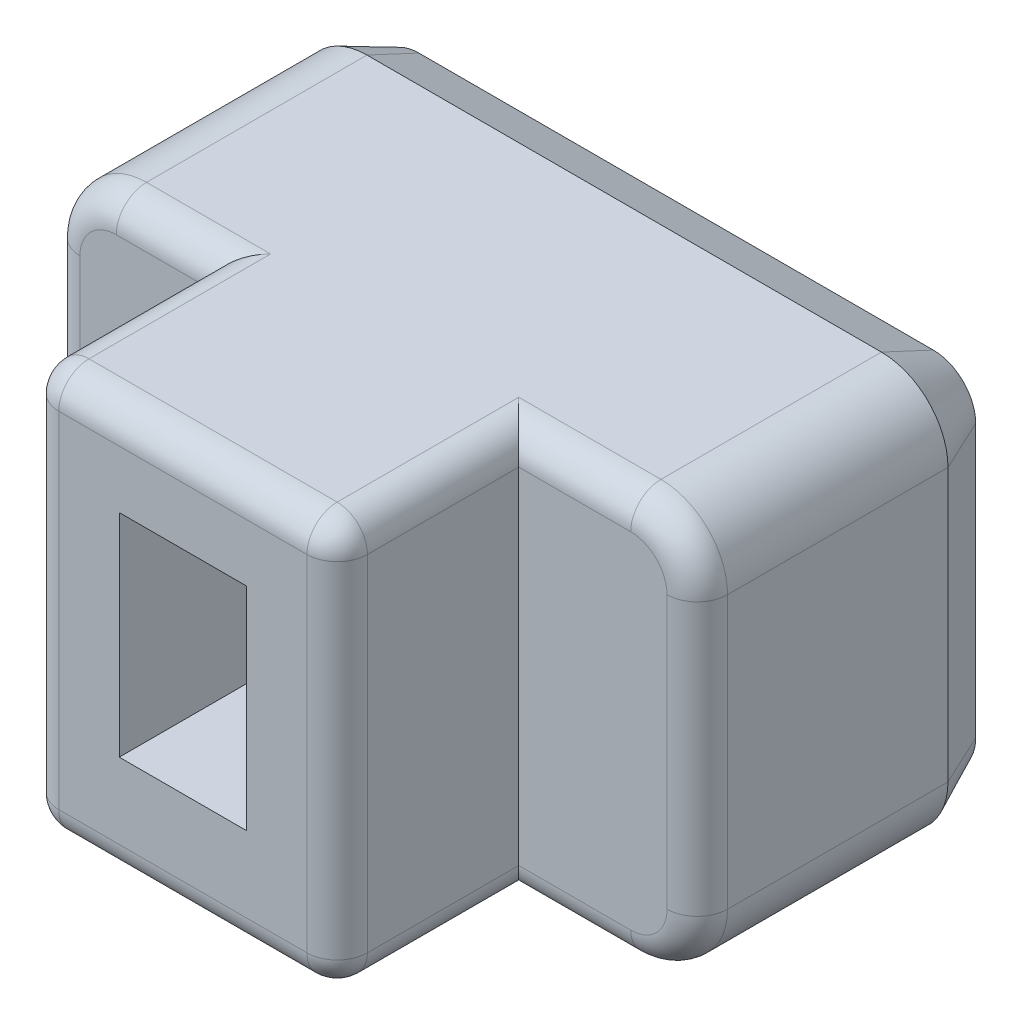
from build123d import *

# Parameters (mm, degrees)
BOSS_EXTRU_1_DEPTH      = 8
ESQUISSE3_W             = 2.1
ESQUISSE3_H             = 3.5
ENL_V_MAT_EXTRU_1_DEPTH = 3
ESQUISSE4_OUTSIDE_W     = 15.69
ESQUISSE4_OUTSIDE_H     = 11.69
ESQUISSE4_OUTSIDE_W_2   = 5.1
ESQUISSE4_OUTSIDE_H_2   = 6.7
ENL_V_MAT_EXTRU_2_DEPTH = 3
CONG_1_R                = 0.5
CHANFREIN1_SIZE         = 0.4
CHANFREIN1_SIZE2        = 0.857802768
ENL_V_MAT_EXTRU_3_DEPTH = 0.3
BOSS_EXTRU_2_START      = -0.2
BOSS_EXTRU_2_DEPTH      = 0.2
BOSS_EXTRU_2_2_DEPTH    = 0.2
BOSS_EXTRU_2_3_DEPTH    = 0.2


with BuildPart() as part:
    # Esquisse2 → Boss.-Extru.1 (new body)
    with BuildSketch(Plane.XY):
        with BuildLine():
            Line((1.1, 0), (9.6, 0))
            ThreePointArc((9.6, 0), (10.377817459, 0.322182541), (10.7, 1.1))
            Line((10.7, 1.1), (10.7, 5.6))
            ThreePointArc((10.7, 5.6), (10.377817459, 6.377817459), (9.6, 6.7))
            Line((9.6, 6.7), (1.1, 6.7))
            ThreePointArc((1.1, 6.7), (0.322182541, 6.377817459), (0, 5.6))
            Line((0, 5.6), (0, 1.1))
            ThreePointArc((0, 1.1), (0.322182541, 0.322182541), (1.1, 0))
        make_face()
    extrude(amount=BOSS_EXTRU_1_DEPTH)

    # Esquisse3 → Enlèv. mat.-Extru.1 (cut)
    with BuildSketch(Plane.XY.offset(8)):
        with Locations((5.2, 3.5)):
            Rectangle(ESQUISSE3_W, ESQUISSE3_H)
    extrude(amount=-ENL_V_MAT_EXTRU_1_DEPTH, mode=Mode.SUBTRACT)

    # Esquisse4 outside → Enlèv. mat.-Extru.2 (cut)
    with BuildSketch(Plane.XY.offset(8)):
        with Locations((5.35, 3.35)):
            Rectangle(ESQUISSE4_OUTSIDE_W, ESQUISSE4_OUTSIDE_H)
        with Locations((5.2, 3.35)):
            Rectangle(ESQUISSE4_OUTSIDE_W_2, ESQUISSE4_OUTSIDE_H_2, mode=Mode.SUBTRACT)
    extrude(amount=-ENL_V_MAT_EXTRU_2_DEPTH, mode=Mode.SUBTRACT)

    # Congé1
    cong_1_edges = [part.edges().sort_by_distance(p)[0] for p in [
        (8.675, 0, 5),
        (10.377817459, 0.322182541, 5),
        (10.7, 3.35, 5),
        (10.377817459, 6.377817459, 5),
        (1.875, 6.7, 5),
        (0.322182541, 6.377817459, 5),
        (1.875, 0, 5),
        (0.322182541, 0.322182541, 5),
        (7.75, 6.7, 6.5),
        (2.65, 6.7, 6.5),
        (7.75, 0, 6.5),
        (2.65, 0, 6.5),
        (2.65, 3.35, 8),
        (5.2, 6.7, 8),
        (7.75, 3.35, 8),
        (5.2, 0, 8),
        (8.675, 6.7, 5),
        (0, 3.35, 5),
    ]]
    fillet(cong_1_edges, radius=CONG_1_R)

    # Chanfrein1
    chanfrein1_edges = [part.edges().sort_by_distance(p)[0] for p in [
        (5.35, 0, 0),
        (10.377817459, 0.322182541, 0),
        (0.322182541, 0.322182541, 0),
        (10.7, 3.35, 0),
        (0, 3.35, 0),
        (10.377817459, 6.377817459, 0),
        (0.322182541, 6.377817459, 0),
        (5.35, 6.7, 0),
    ]]
    chanfrein1_side = [part.faces().sort_by_distance(p)[0] for p in [
        (5.35, 3.35, 0),
    ]]
    chamfer(chanfrein1_edges, length=CHANFREIN1_SIZE, length2=CHANFREIN1_SIZE2, reference=chanfrein1_side[0])

    # Esquisse5 → Enlèv. mat.-Extru.3 (cut)
    # profile 1 of 3: a face of its own
    with BuildSketch(Plane.XY.offset(0.2)):
        Polygon((1.997977699, 1.356639893), (3.331311033, 5.356639893), (2.996375135, 5.356639893), (2.569291802, 4.074588611), (1.375381546, 4.074588611), (0.948298212, 5.356639893), (0.613362315, 5.356639893), (1.946695648, 1.356639893), align=None)
        Polygon((1.972336674, 2.284524508), (1.512400776, 3.6643322), (2.432272571, 3.6643322), align=None, mode=Mode.SUBTRACT)
    # profile 2 of 3: a face of its own
    with BuildSketch(Plane.XY.offset(0.2)):
        with BuildLine():
            Line((3.997977699, 1.356639893), (4.618971289, 1.356639893))
            add(Edge.make_bspline(
                [(4.618971289, 1.356639893), (4.660370521, 1.356813621), (4.739704464, 1.357146539), (4.853801988, 1.359104556), (4.957398686, 1.364479114), (5.050738981, 1.369222879), (5.133209245, 1.377804995), (5.205522494, 1.385906574), (5.267389148, 1.396817021), (5.304652104, 1.406636008), (5.321695648, 1.411127072)],
                knots=[0, 0, 0, 0, 1.406291012, 2.694895705, 3.875596585, 4.929939196, 5.86881668, 6.691431991, 7.401479668, 8, 8, 8, 8], degree=3))
            add(Edge.make_bspline(
                [(5.321695648, 1.411127072), (5.344297076, 1.418428314), (5.389547107, 1.433046038), (5.454159234, 1.46286216), (5.515544106, 1.498696692), (5.574369723, 1.539177196), (5.628863116, 1.587041789), (5.680260141, 1.640360733), (5.729292041, 1.69860091), (5.774152534, 1.763055522), (5.814639121, 1.832154913), (5.850235546, 1.9054881), (5.879774035, 1.983084396), (5.904694998, 2.064083165), (5.922982569, 2.149419581), (5.936340203, 2.238264035), (5.94579905, 2.331064541), (5.946393835, 2.394275862), (5.946695648, 2.426351431)],
                knots=[0, 0, 0, 0, 0.890159445, 1.782176851, 2.661847792, 3.553865198, 4.455671456, 5.376579952, 6.329510008, 7.307692435, 8.31786882, 9.330376746, 10.36095783, 11.428835377, 12.505555716, 13.63040485, 14.79758702, 16, 16, 16, 16], degree=3))
            add(Edge.make_bspline(
                [(5.946695648, 2.426351431), (5.945456092, 2.479585552), (5.943046099, 2.583085428), (5.920166925, 2.733381187), (5.882445809, 2.873658567), (5.83092137, 3.003826255), (5.764507104, 3.121306556), (5.684549952, 3.224172472), (5.592014436, 3.31220369), (5.503939165, 3.372432668), (5.426038142, 3.411355683), (5.362667759, 3.438398436), (5.293139827, 3.459383296), (5.218866232, 3.477967155), (5.139088263, 3.492294901), (5.054279179, 3.502502476), (4.964157513, 3.509042475), (4.902369615, 3.509995582), (4.870573853, 3.510486047)],
                knots=[0, 0, 0, 0, 1.4629789, 2.844381281, 4.168060411, 5.450008344, 6.683409462, 7.866022178, 9.019310308, 10.182424534, 10.783479041, 11.412251156, 12.074243506, 12.777826466, 13.516816875, 14.301129003, 15.125768982, 16, 16, 16, 16], degree=3))
            Line((4.870573853, 3.510486047), (5.997977699, 5.356639893))
            Line((5.997977699, 5.356639893), (5.606150776, 5.356639893))
            Line((5.606150776, 5.356639893), (4.47874693, 3.510486047))
            Line((4.47874693, 3.510486047), (4.305670007, 3.510486047))
            Line((4.305670007, 3.510486047), (4.305670007, 5.356639893))
            Line((4.305670007, 5.356639893), (3.997977699, 5.356639893))
            Line((3.997977699, 5.356639893), (3.997977699, 1.356639893))
        make_face()
        with BuildLine():
            Line((4.305670007, 1.766896303), (4.305670007, 3.100229636))
            Line((4.305670007, 3.100229636), (4.84974052, 3.105838611))
            add(Edge.make_bspline(
                [(4.84974052, 3.105838611), (4.89919209, 3.105003235), (4.991099415, 3.103450663), (5.119067912, 3.090161011), (5.226891868, 3.068473752), (5.316131668, 3.034902158), (5.390657134, 2.990811383), (5.45414033, 2.935370529), (5.510610854, 2.869723746), (5.55596613, 2.792739243), (5.5930566, 2.708571743), (5.619136065, 2.618549669), (5.635845962, 2.523655081), (5.637935112, 2.458741779), (5.63900334, 2.425550149)],
                knots=[0, 0, 0, 0, 1.484367149, 2.7587438, 3.858219379, 4.777130865, 5.607825064, 6.443728638, 7.29703089, 8.19649044, 9.115786766, 10.05213422, 11.004012465, 12, 12, 12, 12], degree=3))
            add(Edge.make_bspline(
                [(5.63900334, 2.425550149), (5.637902238, 2.393429835), (5.63573189, 2.330118533), (5.619254805, 2.237566534), (5.592836367, 2.149136382), (5.555517868, 2.066752424), (5.509489123, 1.992094465), (5.455420233, 1.928385397), (5.39539409, 1.875124486), (5.339072236, 1.839875137), (5.28813598, 1.818640345), (5.244345228, 1.804070943), (5.194243624, 1.793498225), (5.138924137, 1.783863762), (5.078000802, 1.775783408), (5.011417127, 1.770367626), (4.938983151, 1.767120369), (4.888739929, 1.766973058), (4.862561033, 1.766896303)],
                knots=[0, 0, 0, 0, 1.313137682, 2.588282835, 3.832400214, 5.079152676, 6.276491617, 7.408087164, 8.484055822, 9.548258813, 10.106251373, 10.738443295, 11.432799069, 12.197886161, 13.035284822, 13.945215938, 14.92936841, 16, 16, 16, 16], degree=3))
            Line((4.862561033, 1.766896303), (4.305670007, 1.766896303))
        make_face(mode=Mode.SUBTRACT)
    # profile 3 of 3: a face of its own
    with BuildSketch(Plane.XY.offset(0.2)):
        Polygon((6.510798212, 5.356639893), (6.899420007, 1.356639893), (7.015605905, 1.356639893), (8.22874693, 4.638691175), (9.434676417, 1.356639893), (9.555670007, 1.356639893), (9.946695648, 5.356639893), (9.638202058, 5.356639893), (9.356952058, 2.484845021), (8.302464879, 5.356639893), (8.161439238, 5.356639893), (7.100541802, 2.484845021), (6.821695648, 5.356639893), align=None)
    extrude(amount=-ENL_V_MAT_EXTRU_3_DEPTH, mode=Mode.SUBTRACT)


with BuildPart() as body_2:
    # Esquisse5<3> → Boss.-Extru.2 (new body)
    with BuildSketch(Plane.XY.offset(0.2).offset(BOSS_EXTRU_2_START)):
        Polygon((1.997977699, 1.356639893), (3.331311033, 5.356639893), (2.996375135, 5.356639893), (2.569291802, 4.074588611), (1.375381546, 4.074588611), (0.948298212, 5.356639893), (0.613362315, 5.356639893), (1.946695648, 1.356639893), align=None)
        Polygon((1.972336674, 2.284524508), (1.512400776, 3.6643322), (2.432272571, 3.6643322), align=None, mode=Mode.SUBTRACT)
    extrude(amount=-BOSS_EXTRU_2_DEPTH)


with BuildPart() as body_3:
    # Esquisse5<3> → Boss.-Extru.2 2 (new body)
    with BuildSketch(Plane.XY.offset(0.2).offset(BOSS_EXTRU_2_START)):
        with BuildLine():
            Line((3.997977699, 1.356639893), (4.618971289, 1.356639893))
            add(Edge.make_bspline(
                [(4.618971289, 1.356639893), (4.660370521, 1.356813621), (4.739704464, 1.357146539), (4.853801988, 1.359104556), (4.957398686, 1.364479114), (5.050738981, 1.369222879), (5.133209245, 1.377804995), (5.205522494, 1.385906574), (5.267389148, 1.396817021), (5.304652104, 1.406636008), (5.321695648, 1.411127072)],
                knots=[0, 0, 0, 0, 1.406291012, 2.694895705, 3.875596585, 4.929939196, 5.86881668, 6.691431991, 7.401479668, 8, 8, 8, 8], degree=3))
            add(Edge.make_bspline(
                [(5.321695648, 1.411127072), (5.344297076, 1.418428314), (5.389547107, 1.433046038), (5.454159234, 1.46286216), (5.515544106, 1.498696692), (5.574369723, 1.539177196), (5.628863116, 1.587041789), (5.680260141, 1.640360733), (5.729292041, 1.69860091), (5.774152534, 1.763055522), (5.814639121, 1.832154913), (5.850235546, 1.9054881), (5.879774035, 1.983084396), (5.904694998, 2.064083165), (5.922982569, 2.149419581), (5.936340203, 2.238264035), (5.94579905, 2.331064541), (5.946393835, 2.394275862), (5.946695648, 2.426351431)],
                knots=[0, 0, 0, 0, 0.890159445, 1.782176851, 2.661847792, 3.553865198, 4.455671456, 5.376579952, 6.329510008, 7.307692435, 8.31786882, 9.330376746, 10.36095783, 11.428835377, 12.505555716, 13.63040485, 14.79758702, 16, 16, 16, 16], degree=3))
            add(Edge.make_bspline(
                [(5.946695648, 2.426351431), (5.945456092, 2.479585552), (5.943046099, 2.583085428), (5.920166925, 2.733381187), (5.882445809, 2.873658567), (5.83092137, 3.003826255), (5.764507104, 3.121306556), (5.684549952, 3.224172472), (5.592014436, 3.31220369), (5.503939165, 3.372432668), (5.426038142, 3.411355683), (5.362667759, 3.438398436), (5.293139827, 3.459383296), (5.218866232, 3.477967155), (5.139088263, 3.492294901), (5.054279179, 3.502502476), (4.964157513, 3.509042475), (4.902369615, 3.509995582), (4.870573853, 3.510486047)],
                knots=[0, 0, 0, 0, 1.4629789, 2.844381281, 4.168060411, 5.450008344, 6.683409462, 7.866022178, 9.019310308, 10.182424534, 10.783479041, 11.412251156, 12.074243506, 12.777826466, 13.516816875, 14.301129003, 15.125768982, 16, 16, 16, 16], degree=3))
            Line((4.870573853, 3.510486047), (5.997977699, 5.356639893))
            Line((5.997977699, 5.356639893), (5.606150776, 5.356639893))
            Line((5.606150776, 5.356639893), (4.47874693, 3.510486047))
            Line((4.47874693, 3.510486047), (4.305670007, 3.510486047))
            Line((4.305670007, 3.510486047), (4.305670007, 5.356639893))
            Line((4.305670007, 5.356639893), (3.997977699, 5.356639893))
            Line((3.997977699, 5.356639893), (3.997977699, 1.356639893))
        make_face()
        with BuildLine():
            Line((4.305670007, 1.766896303), (4.305670007, 3.100229636))
            Line((4.305670007, 3.100229636), (4.84974052, 3.105838611))
            add(Edge.make_bspline(
                [(4.84974052, 3.105838611), (4.89919209, 3.105003235), (4.991099415, 3.103450663), (5.119067912, 3.090161011), (5.226891868, 3.068473752), (5.316131668, 3.034902158), (5.390657134, 2.990811383), (5.45414033, 2.935370529), (5.510610854, 2.869723746), (5.55596613, 2.792739243), (5.5930566, 2.708571743), (5.619136065, 2.618549669), (5.635845962, 2.523655081), (5.637935112, 2.458741779), (5.63900334, 2.425550149)],
                knots=[0, 0, 0, 0, 1.484367149, 2.7587438, 3.858219379, 4.777130865, 5.607825064, 6.443728638, 7.29703089, 8.19649044, 9.115786766, 10.05213422, 11.004012465, 12, 12, 12, 12], degree=3))
            add(Edge.make_bspline(
                [(5.63900334, 2.425550149), (5.637902238, 2.393429835), (5.63573189, 2.330118533), (5.619254805, 2.237566534), (5.592836367, 2.149136382), (5.555517868, 2.066752424), (5.509489123, 1.992094465), (5.455420233, 1.928385397), (5.39539409, 1.875124486), (5.339072236, 1.839875137), (5.28813598, 1.818640345), (5.244345228, 1.804070943), (5.194243624, 1.793498225), (5.138924137, 1.783863762), (5.078000802, 1.775783408), (5.011417127, 1.770367626), (4.938983151, 1.767120369), (4.888739929, 1.766973058), (4.862561033, 1.766896303)],
                knots=[0, 0, 0, 0, 1.313137682, 2.588282835, 3.832400214, 5.079152676, 6.276491617, 7.408087164, 8.484055822, 9.548258813, 10.106251373, 10.738443295, 11.432799069, 12.197886161, 13.035284822, 13.945215938, 14.92936841, 16, 16, 16, 16], degree=3))
            Line((4.862561033, 1.766896303), (4.305670007, 1.766896303))
        make_face(mode=Mode.SUBTRACT)
    extrude(amount=-BOSS_EXTRU_2_2_DEPTH)


with BuildPart() as body_4:
    # Esquisse5<3> → Boss.-Extru.2 3 (new body)
    with BuildSketch(Plane.XY.offset(0.2).offset(BOSS_EXTRU_2_START)):
        Polygon((6.510798212, 5.356639893), (6.899420007, 1.356639893), (7.015605905, 1.356639893), (8.22874693, 4.638691175), (9.434676417, 1.356639893), (9.555670007, 1.356639893), (9.946695648, 5.356639893), (9.638202058, 5.356639893), (9.356952058, 2.484845021), (8.302464879, 5.356639893), (8.161439238, 5.356639893), (7.100541802, 2.484845021), (6.821695648, 5.356639893), align=None)
    extrude(amount=-BOSS_EXTRU_2_3_DEPTH)


solid = Compound([part.part, body_2.part, body_3.part, body_4.part])
